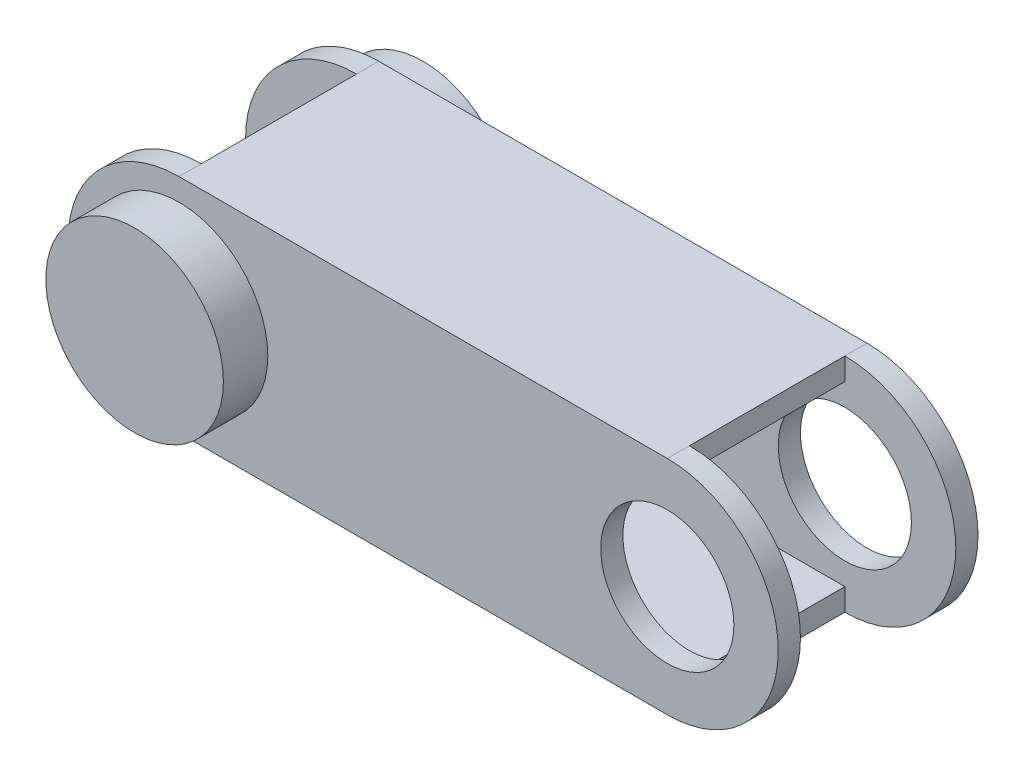
from build123d import *

# Parameters (mm, degrees)
SKETCH1_R           = 30
BOSS_EXTRUDE2_DEPTH = 10
SKETCH3_W           = 220
SKETCH3_H           = 80
BOSS_EXTRUDE3_DEPTH = 10
SKETCH4_R           = 40
BOSS_EXTRUDE4_DEPTH = 30


with BuildPart() as part:
    # Sketch1 → Boss-Extrude2 (new body)
    with BuildSketch(Plane.XY):
        with BuildLine():
            Line((0, -50), (-220, -50))
            ThreePointArc((-220, -50), (-270, 0), (-220, 50))
            Line((-220, 50), (0, 50))
            ThreePointArc((0, 50), (50, 0), (0, -50))
        make_face()
        Circle(SKETCH1_R, mode=Mode.SUBTRACT)
    boss_extrude2 = extrude(amount=BOSS_EXTRUDE2_DEPTH)

    # Sketch3 → Boss-Extrude3 (add)
    with BuildSketch(Plane.XZ.offset(50)):
        with Locations((-110, -40)):
            Rectangle(SKETCH3_W, SKETCH3_H)
    boss_extrude3 = extrude(amount=-BOSS_EXTRUDE3_DEPTH)

    # Sketch4 → Boss-Extrude4 (add)
    with BuildSketch(Plane.XY):
        with Locations((-220, 0)):
            Circle(SKETCH4_R)
    boss_extrude4 = extrude(amount=BOSS_EXTRUDE4_DEPTH)

    # Mirror1: Boss-Extrude2, Boss-Extrude3, Boss-Extrude4 across plane
    add(boss_extrude2.mirror(Plane(origin=(0, 0, -35), x_dir=(1, 0, 0), z_dir=(0, 0, -1))))
    add(boss_extrude3.mirror(Plane(origin=(0, 0, -35), x_dir=(1, 0, 0), z_dir=(0, 0, -1))))
    add(boss_extrude4.mirror(Plane(origin=(0, 0, -35), x_dir=(1, 0, 0), z_dir=(0, 0, -1))))

    # Mirror2: Boss-Extrude3 across plane
    add(boss_extrude3.mirror(Plane.ZX))


solid = part.part
